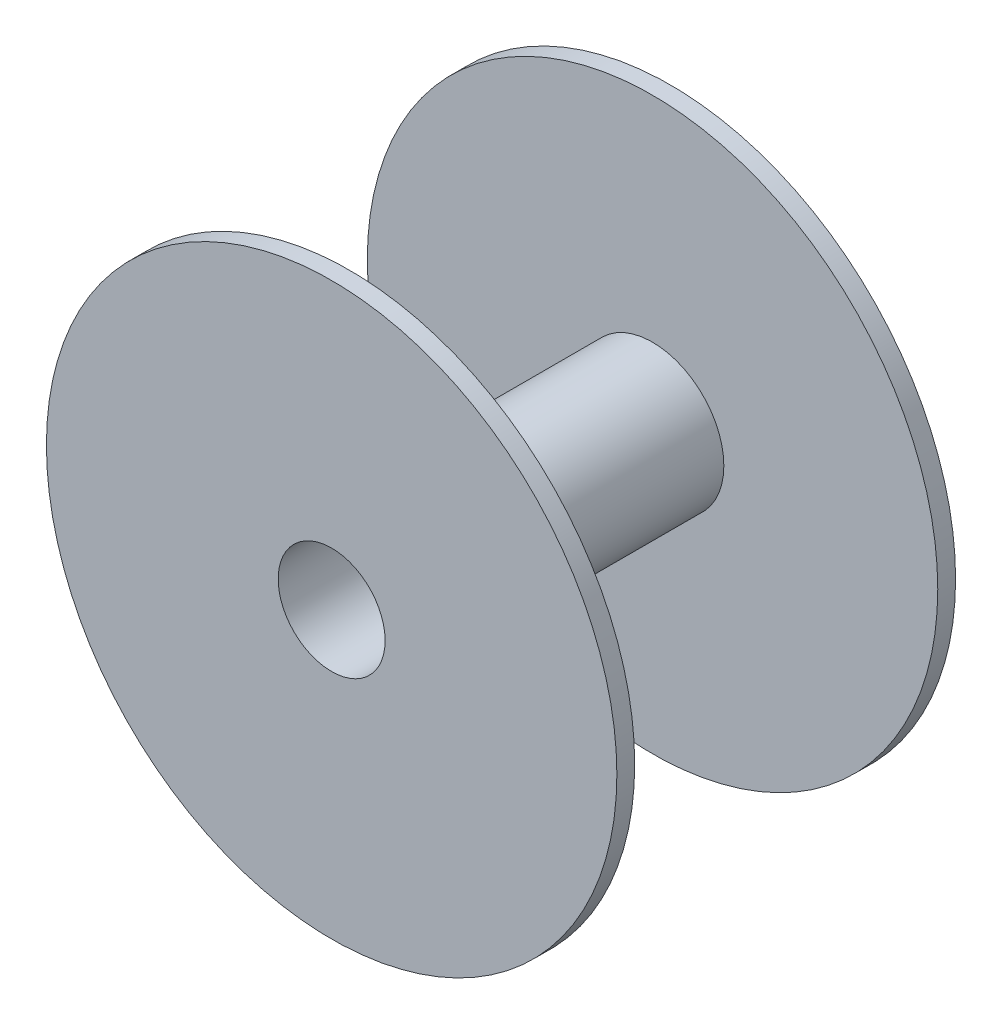
from build123d import *

# Parameters (mm, degrees)
SKETCH1_R           = 80
SKETCH1_R_2         = 15
BOSS_EXTRUDE1_DEPTH = 95
SHELL1_T            = -5


with BuildPart() as part:
    # Sketch1 → Boss-Extrude1 (new body)
    with BuildSketch(Plane.XY):
        Circle(SKETCH1_R)
        Circle(SKETCH1_R_2, mode=Mode.SUBTRACT)
    extrude(amount=BOSS_EXTRUDE1_DEPTH)

    # Shell1
    shell1_openings = [part.faces().sort_by_distance(p)[0] for p in [
        (-80, 0, 47.5),
    ]]
    offset(amount=SHELL1_T, openings=shell1_openings, kind=Kind.INTERSECTION)


solid = part.part
